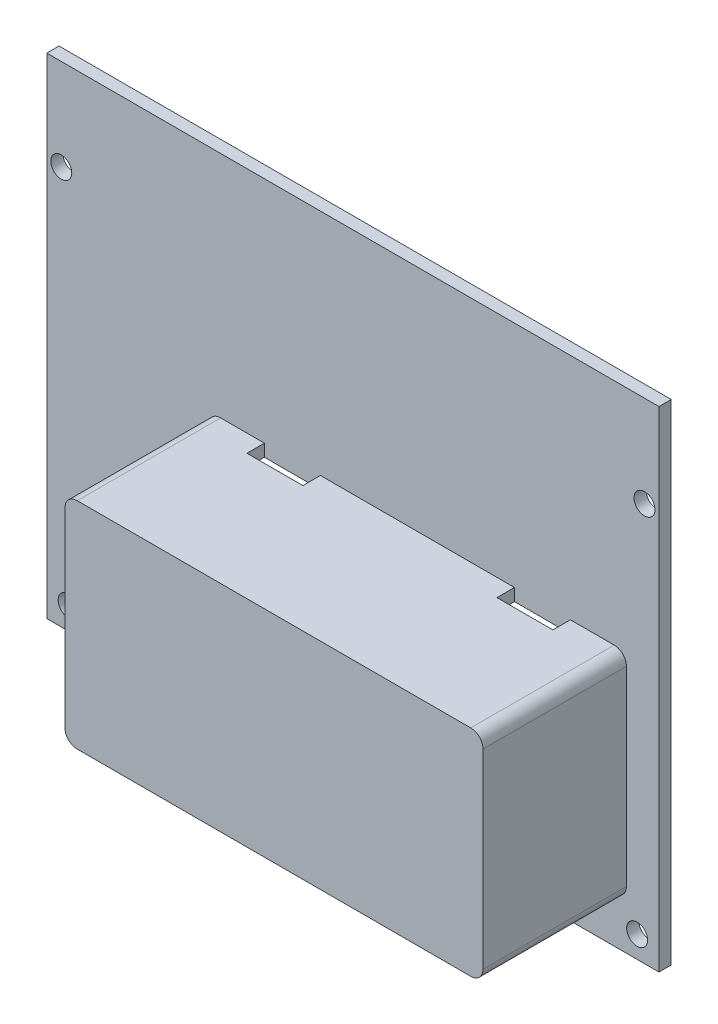
from build123d import *

# Parameters (mm, degrees)
SKETCH1_W           = 88.9
SKETCH1_H           = 71.12
BOSS_EXTRUDE1_DEPTH = 1.778
SKETCH2_R           = 1.524
CUT_EXTRUDE1_DEPTH  = 2.54
BOSS_EXTRUDE2_DEPTH = 19.05
CUT_EXTRUDE2_START  = -1.778
CUT_EXTRUDE2_DEPTH  = 1.778
BOSS_EXTRUDE3_DEPTH = 2.54
BOSS_EXTRUDE4_DEPTH = 3.81
BOSS_EXTRUDE5_DEPTH = 1.778
SKETCH10_W          = 19.05
SKETCH10_H          = 9.906
CUT_EXTRUDE5_DEPTH  = 1.778
SKETCH12_W          = 8.128
SKETCH12_H          = 2.54
CUT_EXTRUDE6_DEPTH  = 8.509
SKETCH14_R          = 1.27
CUT_EXTRUDE7_DEPTH  = 3.81


with BuildPart() as part:
    # Sketch1 → Boss-Extrude1 (new body)
    with BuildSketch(Plane.XY):
        Rectangle(SKETCH1_W, SKETCH1_H)
    extrude(amount=BOSS_EXTRUDE1_DEPTH)

    # Sketch2 → Cut-Extrude1 (cut)
    with BuildSketch(Plane(origin=(0, 0, 0), x_dir=(-1, 0, 0), z_dir=(0, 0, -1))):
        with Locations((-42.344998858, 22.278284854)):
            Circle(SKETCH2_R)
        with Locations((42.344998858, 22.278284854)):
            Circle(SKETCH2_R)
        with Locations((41.275, -32.385)):
            Circle(SKETCH2_R)
        with Locations((-41.275, -32.385)):
            Circle(SKETCH2_R)
    extrude(amount=-CUT_EXTRUDE1_DEPTH, mode=Mode.SUBTRACT)

    # Sketch3 → Boss-Extrude2 (add)
    with BuildSketch(Plane.XY.offset(1.778)):
        with BuildLine():
            Line((-20.982004201, 0.529316706), (-20.982004201, -27.156683294))
            ThreePointArc((-20.982004201, -27.156683294), (-20.461240058, -28.413919151), (-19.204004201, -28.934683294))
            Line((-19.204004201, -28.934683294), (37.945995799, -28.934683294))
            ThreePointArc((37.945995799, -28.934683294), (39.203231656, -28.413919151), (39.723995799, -27.156683294))
            Line((39.723995799, -27.156683294), (39.723995799, 0.529316706))
            ThreePointArc((39.723995799, 0.529316706), (39.203231656, 1.786552563), (37.945995799, 2.307316706))
            Line((37.945995799, 2.307316706), (-19.204004201, 2.307316706))
            ThreePointArc((-19.204004201, 2.307316706), (-20.461240058, 1.786552563), (-20.982004201, 0.529316706))
        make_face()
        with BuildLine():
            Line((-19.204004201, -1.248683294), (-19.204004201, -25.378683294))
            ThreePointArc((-19.204004201, -25.378683294), (-18.683240058, -26.635919151), (-17.426004201, -27.156683294))
            Line((-17.426004201, -27.156683294), (36.167995799, -27.156683294))
            ThreePointArc((36.167995799, -27.156683294), (37.425231656, -26.635919151), (37.945995799, -25.378683294))
            Line((37.945995799, -25.378683294), (37.945995799, -1.248683294))
            ThreePointArc((37.945995799, -1.248683294), (37.425231656, 0.008552563), (36.167995799, 0.529316706))
            Line((36.167995799, 0.529316706), (-17.426004201, 0.529316706))
            ThreePointArc((-17.426004201, 0.529316706), (-18.683240058, 0.008552563), (-19.204004201, -1.248683294))
        make_face(mode=Mode.SUBTRACT)
    extrude(amount=BOSS_EXTRUDE2_DEPTH)

    # Sketch4 → Cut-Extrude2 (cut)
    with BuildSketch(Plane.XY.offset(1.778).offset(CUT_EXTRUDE2_START)):
        with BuildLine():
            Line((-17.426004201, 0.529316706), (36.167995799, 0.529316706))
            ThreePointArc((36.167995799, 0.529316706), (37.425231656, 0.008552563), (37.945995799, -1.248683294))
            Line((37.945995799, -1.248683294), (37.945995799, -25.378683294))
            ThreePointArc((37.945995799, -25.378683294), (37.425231656, -26.635919151), (36.167995799, -27.156683294))
            Line((36.167995799, -27.156683294), (-17.426004201, -27.156683294))
            ThreePointArc((-17.426004201, -27.156683294), (-18.683240058, -26.635919151), (-19.204004201, -25.378683294))
            Line((-19.204004201, -25.378683294), (-19.204004201, -1.248683294))
            ThreePointArc((-19.204004201, -1.248683294), (-18.683240058, 0.008552563), (-17.426004201, 0.529316706))
        make_face()
    extrude(amount=CUT_EXTRUDE2_DEPTH, mode=Mode.SUBTRACT)

    # Sketch5 → Boss-Extrude3 (add)
    with BuildSketch(Plane.XY.offset(1.778)):
        with BuildLine():
            Line((-12.845316988, 2.307316706), (-4.717316988, 2.307316706))
            ThreePointArc((-4.717316988, 2.307316706), (-8.781316988, 6.371316706), (-12.845316988, 2.307316706))
        make_face()
        with BuildLine():
            Line((31.587308585, 2.307316706), (23.459308585, 2.307316706))
            ThreePointArc((23.459308585, 2.307316706), (27.523308585, 6.371316706), (31.587308585, 2.307316706))
        make_face()
        with BuildLine():
            Line((5.306995799, -28.934683294), (13.434995799, -28.934683294))
            ThreePointArc((13.434995799, -28.934683294), (9.370995799, -32.998683294), (5.306995799, -28.934683294))
        make_face()
    extrude(amount=BOSS_EXTRUDE3_DEPTH)

    # Sketch6 → Boss-Extrude4 (add)
    with BuildSketch(Plane.XY.offset(4.318)):
        with BuildLine():
            Line((5.306995799, -28.934683294), (13.434995799, -28.934683294))
            ThreePointArc((13.434995799, -28.934683294), (9.370995799, -32.998683294), (5.306995799, -28.934683294))
        make_face()
    extrude(amount=BOSS_EXTRUDE4_DEPTH)

    # Sketch7 → Boss-Extrude5 (add)
    with BuildSketch(Plane.XY.offset(20.828)):
        with BuildLine():
            Line((-19.204004201, 2.307316706), (37.945995799, 2.307316706))
            ThreePointArc((37.945995799, 2.307316706), (39.203231656, 1.786552563), (39.723995799, 0.529316706))
            Line((39.723995799, 0.529316706), (39.723995799, -27.156683294))
            ThreePointArc((39.723995799, -27.156683294), (39.203231656, -28.413919151), (37.945995799, -28.934683294))
            Line((37.945995799, -28.934683294), (-19.204004201, -28.934683294))
            ThreePointArc((-19.204004201, -28.934683294), (-20.461240058, -28.413919151), (-20.982004201, -27.156683294))
            Line((-20.982004201, -27.156683294), (-20.982004201, 0.529316706))
            ThreePointArc((-20.982004201, 0.529316706), (-20.461240058, 1.786552563), (-19.204004201, 2.307316706))
        make_face()
    extrude(amount=BOSS_EXTRUDE5_DEPTH)

    # Sketch10 → Cut-Extrude5 (cut)
    with BuildSketch(Plane.ZY.offset(20.982004201)):
        with Locations((11.303, -13.313683294)):
            Rectangle(SKETCH10_W, SKETCH10_H)
    extrude(amount=-CUT_EXTRUDE5_DEPTH, mode=Mode.SUBTRACT)

    # Sketch12 → Cut-Extrude6 (cut, symmetric)
    with BuildSketch(Plane(origin=(0, 2.307316706, 0), x_dir=(1, 0, 0), z_dir=(0, 1, 0))):
        with Locations((-8.781316988, -3.048)):
            Rectangle(SKETCH12_W, SKETCH12_H)
        with Locations((27.523308585, -3.048)):
            Rectangle(SKETCH12_W, SKETCH12_H)
    extrude(amount=CUT_EXTRUDE6_DEPTH, both=True, mode=Mode.SUBTRACT)

    # Sketch14 → Cut-Extrude7 (cut)
    with BuildSketch(Plane(origin=(0, 0, 0), x_dir=(-1, 0, 0), z_dir=(0, 0, -1))):
        with Locations((-9.370995799, -29.824748275)):
            Circle(SKETCH14_R)
    extrude(amount=-CUT_EXTRUDE7_DEPTH, mode=Mode.SUBTRACT)


solid = part.part
